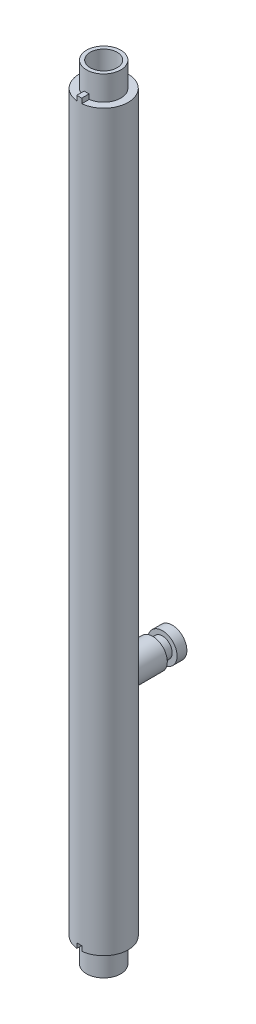
from build123d import *
from build123d.topology import SkipClean

# Parameters (mm, degrees)
SKETCH1_R                            = 5
BOSS_EXTRUDE1_DEPTH                  = 150
SKETCH4_R                            = 3
BOSS_EXTRUDE2_DEPTH                  = 5
BOSS_EXTRUDE2_DIRECTION_2_REACH      = 152.416
BOSS_EXTRUDE2_DIRECTION_2_END_RADIUS = 5
SKETCH5_R                            = 2
BOSS_EXTRUDE3_DEPTH                  = 2
SKETCH6_R                            = 3
BOSS_EXTRUDE4_DEPTH                  = 2
SKETCH7_R                            = 3.5
BOSS_EXTRUDE5_DEPTH                  = 5
BOSS_EXTRUDE6_START                  = 5
SKETCH8_R                            = 3.5
BOSS_EXTRUDE6_DEPTH                  = 5
SKETCH9_R                            = 2.75
CUT_EXTRUDE1_DEPTH                   = 168
CUT_EXTRUDE4_REACH                   = 158.24
CUT_EXTRUDE4_END_RADIUS              = 3.5
BOSS_EXTRUDE7_START                  = 1
BOSS_EXTRUDE7_DEPTH                  = 1
BOSS_EXTRUDE8_REACH                  = 157.812
BOSS_EXTRUDE8_END_RADIUS             = 2
SKETCH18_W                           = 2
SKETCH18_H                           = 0.5


with BuildPart() as part:
    # Sketch1 → Boss-Extrude1 (new body)
    with BuildSketch(Plane(origin=(0, 0, 0), x_dir=(1, 0, 0), z_dir=(0, 1, 0))):
        with Locations(Location((0, 0, 0), (0, 0, 270))):
            Circle(SKETCH1_R)
    extrude(amount=BOSS_EXTRUDE1_DEPTH)

    # Sketch7 → Boss-Extrude5 (add)
    with BuildSketch(Plane.XZ):
        with Locations(Location((0, 0, 0), (0, 0, 270))):
            Circle(SKETCH7_R)
    extrude(amount=BOSS_EXTRUDE5_DEPTH)

    # Sketch8 → Boss-Extrude6 (add)
    with BuildSketch(Plane(origin=(0, 150, 0), x_dir=(1, 0, 0), z_dir=(0, 1, 0)).offset(BOSS_EXTRUDE6_START)):
        with Locations(Location((0, 0, 0), (0, 0, 90))):
            Circle(SKETCH8_R)
    extrude(amount=-BOSS_EXTRUDE6_DEPTH)

    # Sketch9 → Cut-Extrude1 (cut)
    with BuildSketch(Plane(origin=(0, 155, 0), x_dir=(1, 0, 0), z_dir=(0, 1, 0))):
        with Locations(Location((0, 0, 0), (0, 0, 270))):
            Circle(SKETCH9_R)
    extrude(amount=-CUT_EXTRUDE1_DEPTH, mode=Mode.SUBTRACT)

    # Cut-Extrude4: up to this cylinder (the profile starts outside it)
    cut_extrude4_end = Plane(origin=(0, 0.5, 0), z_dir=(0, 1, 0)) * Cylinder(CUT_EXTRUDE4_END_RADIUS, 324.48, mode=Mode.PRIVATE)
    # Sketch14 → Cut-Extrude4 (cut, up to the surface)
    with BuildSketch(Plane.XY.offset(5), mode=Mode.PRIVATE) as cut_extrude4_sk1:
        Polygon((0, 0), (0.5, 0), (0.5, 1), (-0.5, 1), (-0.5, 0), align=None)
    cut_extrude4_tool1 = extrude(cut_extrude4_sk1.sketch, amount=-CUT_EXTRUDE4_REACH, mode=Mode.PRIVATE) - cut_extrude4_end
    add(cut_extrude4_tool1.solids().sort_by_distance((0, 0.5, 5))[0], mode=Mode.SUBTRACT)

    # Sketch16 → Boss-Extrude7 (add)
    with BuildSketch(Plane(origin=(0, 150, 0), x_dir=(1, 0, 0), z_dir=(0, 1, 0)).offset(BOSS_EXTRUDE7_START)):
        with BuildLine():
            Line((0.5, -3.5), (0.5, -4.974937186))
            ThreePointArc((0.5, -4.974937186), (0, -5), (-0.5, -4.974937186))
            Line((-0.5, -4.974937186), (-0.5, -3.5))
            Line((-0.5, -3.5), (-0.5, -3.464101615))
            ThreePointArc((-0.5, -3.464101615), (0, -3.5), (0.5, -3.464101615))
            Line((0.5, -3.464101615), (0.5, -3.5))
        make_face()
    extrude(amount=-BOSS_EXTRUDE7_DEPTH)


with BuildPart() as body_2:
    # Sketch4 → Boss-Extrude2 (new body)
    with BuildSketch(Plane.XY.offset(-5)):
        with Locations((0, 45)):
            Circle(SKETCH4_R)
    extrude(amount=-BOSS_EXTRUDE2_DEPTH)

    # Boss-Extrude2 direction 2: up to this cylinder (the profile starts outside it)
    with SkipClean():  # the faces are left unmerged after this step: merging them gives an invalid solid
        boss_extrude2_direction_2_end = Plane(origin=(0, 45, 0), z_dir=(0, -1, 0)) * Cylinder(BOSS_EXTRUDE2_DIRECTION_2_END_RADIUS, 315.832, mode=Mode.PRIVATE)
        # Sketch4 → Boss-Extrude2 direction 2 (add, up to the surface)
        with BuildSketch(Plane.XY.offset(-5), mode=Mode.PRIVATE) as boss_extrude2_direction_2_sk1:
            with Locations((0, 45)):
                Circle(SKETCH4_R)
        boss_extrude2_direction_2_tool1 = extrude(boss_extrude2_direction_2_sk1.sketch, amount=BOSS_EXTRUDE2_DIRECTION_2_REACH, mode=Mode.PRIVATE) - boss_extrude2_direction_2_end
        add(boss_extrude2_direction_2_tool1.solids().sort_by_distance((0, 45, -5))[0])
        add(boss_extrude2_direction_2_tool1.solids().sort_by_distance((0, 45, -5))[1])

    # Sketch5 → Boss-Extrude3 (add)
    with SkipClean():  # the faces are left unmerged after this step: merging them gives an invalid solid
        with BuildSketch(Plane(origin=(0, 0, -10), x_dir=(-1, 0, 0), z_dir=(0, 0, -1))):
            with Locations((0, 45.074078642)):
                Circle(SKETCH5_R)
        extrude(amount=BOSS_EXTRUDE3_DEPTH)

    # Sketch6 → Boss-Extrude4 (add)
    with SkipClean():  # the faces are left unmerged after this step: merging them gives an invalid solid
        with BuildSketch(Plane(origin=(0, 0, -12), x_dir=(-1, 0, 0), z_dir=(0, 0, -1))):
            with Locations(Location((0, 45, 0), (0, 0, 180))):
                Circle(SKETCH6_R)
        extrude(amount=BOSS_EXTRUDE4_DEPTH)

    # Boss-Extrude8: up to this cylinder (the profile starts outside it)
    with SkipClean():  # the faces are left unmerged after this step: merging them gives an invalid solid
        boss_extrude8_end = Plane(origin=(0, 45.074078642, -11), z_dir=(0, 0, 1)) * Cylinder(BOSS_EXTRUDE8_END_RADIUS, 320.624, mode=Mode.PRIVATE)
        # Sketch18 → Boss-Extrude8 (add, up to the surface)
        with BuildSketch(Plane(origin=(-2.5, 0, 0), x_dir=(0, 0, -1), z_dir=(1, 0, 0)), mode=Mode.PRIVATE) as boss_extrude8_sk1:
            with Locations((11, 45.25)):
                Rectangle(SKETCH18_W, SKETCH18_H)
        boss_extrude8_tool1 = extrude(boss_extrude8_sk1.sketch, amount=BOSS_EXTRUDE8_REACH, mode=Mode.PRIVATE) - boss_extrude8_end
        add(boss_extrude8_tool1.solids().sort_by_distance((-2.5, 45.25, -11))[0])


solid = Compound([part.part, body_2.part])
